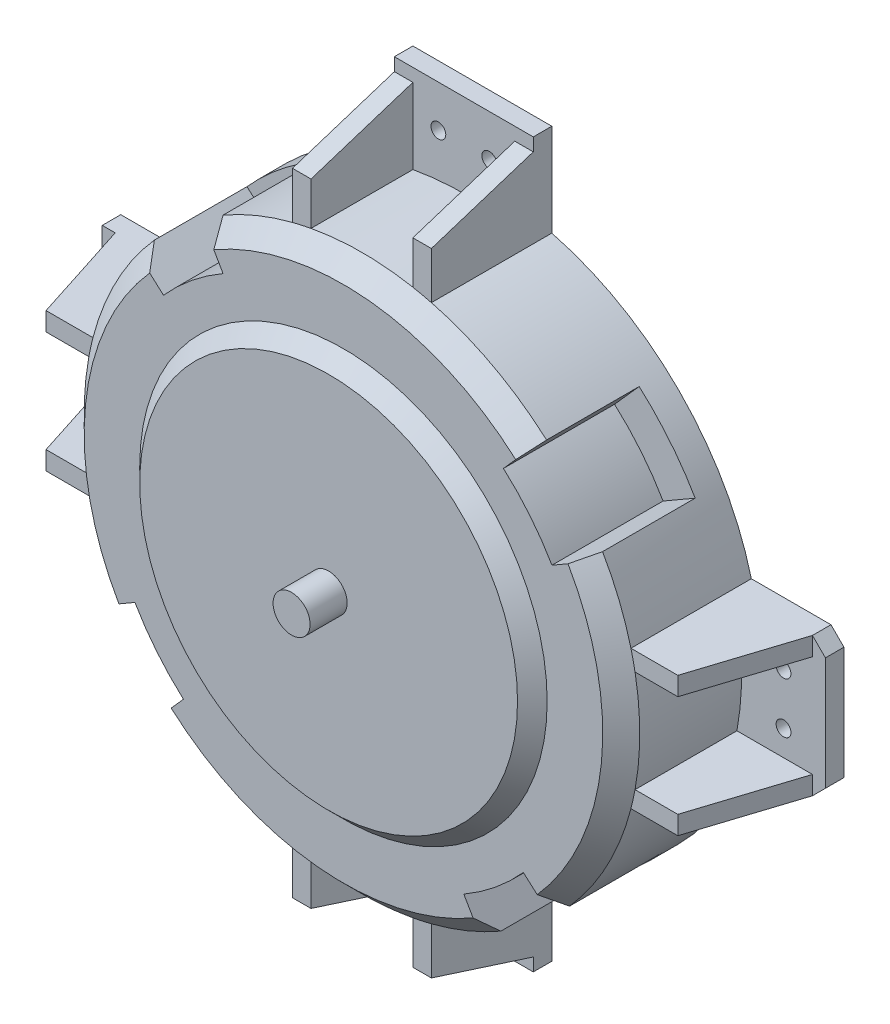
from build123d import *

# Parameters (mm, degrees)
IZIM1_R                           = 150
Y_KSEKLIK_EKSTR_ZYON1_DEPTH       = 75
PAH1_SIZE                         = 10
Y_KSEKLIK_EKSTR_ZYON2_START       = -75
Y_KSEKLIK_EKSTR_ZYON2_DEPTH       = 10
PAH2_SIZE                         = 7
Y_KSEKLIK_EKSTR_ZYON3_DEPTH       = 10
IZIM8_R                           = 4
KES_EKSTR_ZYON1_DEPTH             = 255.641782801
DAIRESEL_KAPLAMA1_COUNT           = 4
DAIRESEL_KAPLAMA1_COPY_1_DEPTH    = 10
DAIRESEL_KAPLAMA1_COPY_2_DEPTH    = 10
DAIRESEL_KAPLAMA1_COPY_3_DEPTH    = 10
DAIRESEL_KAPLAMA1_COPY_4_SKETCH_R = 4
DAIRESEL_KAPLAMA1_COPY_4_DEPTH    = 255.641782801
DAIRESEL_KAPLAMA1_COPY_5_SKETCH_R = 4
DAIRESEL_KAPLAMA1_COPY_5_DEPTH    = 255.641782801
DAIRESEL_KAPLAMA1_COPY_6_SKETCH_R = 4
DAIRESEL_KAPLAMA1_COPY_6_DEPTH    = 255.641782801
KES_EKSTR_ZYON2_START             = -60
KES_EKSTR_ZYON2_DEPTH             = 60
DAIRESEL_KAPLAMA2_COUNT           = 4
IZIM10_R                          = 110
Y_KSEKLIK_EKSTR_ZYON4_DEPTH       = 8
Y_KSEKLIK_EKSTR_ZYON4_TAPER       = 45
IZIM11_R                          = 10
Y_KSEKLIK_EKSTR_ZYON5_DEPTH       = 20


with BuildPart() as part:
    # Çizim1 → Yükseklik-Ekstrüzyon1 (new body)
    with BuildSketch(Plane.XY):
        Circle(IZIM1_R)
    extrude(amount=Y_KSEKLIK_EKSTR_ZYON1_DEPTH)

    # Pah1
    pah1_edges = [part.edges().sort_by_distance(p)[0] for p in [
        (-150, 0, 75),
    ]]
    chamfer(pah1_edges, length=PAH1_SIZE)

    # Çizim4 → Yükseklik-Ekstrüzyon2 (add)
    with BuildSketch(Plane.XY.offset(75).offset(Y_KSEKLIK_EKSTR_ZYON2_START)):
        with BuildLine():
            Line((195.236875483, -37.5), (195.236875483, 37.5))
            Line((195.236875483, 37.5), (145.236875483, 37.5))
            ThreePointArc((145.236875483, 37.5), (150, 0), (145.236875483, -37.5))
            Line((145.236875483, -37.5), (195.236875483, -37.5))
        make_face()
    y_kseklik_ekstr_zyon2 = extrude(amount=Y_KSEKLIK_EKSTR_ZYON2_DEPTH)

    # Pah2
    pah2_edges = [part.edges().sort_by_distance(p)[0] for p in [
        (195.236875483, -37.5, 5),
        (195.236875483, 37.5, 5),
    ]]
    chamfer(pah2_edges, length=PAH2_SIZE)

    # Çizim7 → Yükseklik-Ekstrüzyon3 (add)
    with BuildSketch(Plane(origin=(0, 37.5, 0), x_dir=(1, 0, 0), z_dir=(0, 1, 0))):
        Polygon((145.236875483, 0), (145.236875483, -65.015207496), (170.556875483, -65.015207496), (188.236875483, -10), (188.236875483, 0), align=None)
    y_kseklik_ekstr_zyon3 = extrude(amount=-Y_KSEKLIK_EKSTR_ZYON3_DEPTH)

    # Çizim8 → Kes-Ekstrüzyon1 (cut, through all)
    with BuildSketch(Plane.XY.offset(10)):
        with Locations((172.618437741, 13.75)):
            Circle(IZIM8_R)
    kes_ekstr_zyon1 = extrude(amount=-KES_EKSTR_ZYON1_DEPTH, mode=Mode.SUBTRACT)

    # Aynalama1: Yükseklik-Ekstrüzyon3, Kes-Ekstrüzyon1 across plane
    add(y_kseklik_ekstr_zyon3.mirror(Plane.ZX))
    add(kes_ekstr_zyon1.mirror(Plane.ZX), mode=Mode.SUBTRACT)

    # Dairesel Kaplama1: Yükseklik-Ekstrüzyon2, Yükseklik-Ekstrüzyon3, Kes-Ekstrüzyon1 ×4 about axis
    dairesel_kaplama1_axis = Axis((0, 0, 0), (0, 0, 1))
    add([y_kseklik_ekstr_zyon2.rotate(dairesel_kaplama1_axis, i * 360 / DAIRESEL_KAPLAMA1_COUNT) for i in range(1, DAIRESEL_KAPLAMA1_COUNT)])
    add([y_kseklik_ekstr_zyon3.rotate(dairesel_kaplama1_axis, i * 360 / DAIRESEL_KAPLAMA1_COUNT) for i in range(1, DAIRESEL_KAPLAMA1_COUNT)])
    add([kes_ekstr_zyon1.rotate(dairesel_kaplama1_axis, i * 360 / DAIRESEL_KAPLAMA1_COUNT) for i in range(1, DAIRESEL_KAPLAMA1_COUNT)], mode=Mode.SUBTRACT)

    # Dairesel Kaplama1 copy 1 sketch → Dairesel Kaplama1 copy 1 (add)
    with BuildSketch(Plane.YZ.offset(37.5)):
        Polygon((145.236875483, 0), (145.236875483, 65.015207496), (170.556875483, 65.015207496), (188.236875483, 10), (188.236875483, 0), align=None)
    extrude(amount=-DAIRESEL_KAPLAMA1_COPY_1_DEPTH)

    # Dairesel Kaplama1 copy 2 sketch → Dairesel Kaplama1 copy 2 (add)
    with BuildSketch(Plane(origin=(0, 37.5, 0), x_dir=(-1, 0, 0), z_dir=(0, 1, 0))):
        Polygon((145.236875483, 0), (145.236875483, 65.015207496), (170.556875483, 65.015207496), (188.236875483, 10), (188.236875483, 0), align=None)
    extrude(amount=-DAIRESEL_KAPLAMA1_COPY_2_DEPTH)

    # Dairesel Kaplama1 copy 3 sketch → Dairesel Kaplama1 copy 3 (add)
    with BuildSketch(Plane(origin=(-37.5, 0, 0), x_dir=(0, -1, 0), z_dir=(-1, 0, 0))):
        Polygon((145.236875483, 0), (145.236875483, 65.015207496), (170.556875483, 65.015207496), (188.236875483, 10), (188.236875483, 0), align=None)
    extrude(amount=-DAIRESEL_KAPLAMA1_COPY_3_DEPTH)

    # Dairesel Kaplama1 copy 4 sketch → Dairesel Kaplama1 copy 4 (cut, through all)
    with BuildSketch(Plane(origin=(0, 0, 10), x_dir=(0, 1, 0), z_dir=(0, 0, 1))):
        with Locations((172.618437741, -13.75)):
            Circle(DAIRESEL_KAPLAMA1_COPY_4_SKETCH_R)
    extrude(amount=-DAIRESEL_KAPLAMA1_COPY_4_DEPTH, mode=Mode.SUBTRACT)

    # Dairesel Kaplama1 copy 5 sketch → Dairesel Kaplama1 copy 5 (cut, through all)
    with BuildSketch(Plane(origin=(0, 0, 10), x_dir=(-1, 0, 0), z_dir=(0, 0, 1))):
        with Locations((172.618437741, -13.75)):
            Circle(DAIRESEL_KAPLAMA1_COPY_5_SKETCH_R)
    extrude(amount=-DAIRESEL_KAPLAMA1_COPY_5_DEPTH, mode=Mode.SUBTRACT)

    # Dairesel Kaplama1 copy 6 sketch → Dairesel Kaplama1 copy 6 (cut, through all)
    with BuildSketch(Plane(origin=(0, 0, 10), x_dir=(0, -1, 0), z_dir=(0, 0, 1))):
        with Locations((172.618437741, -13.75)):
            Circle(DAIRESEL_KAPLAMA1_COPY_6_SKETCH_R)
    extrude(amount=-DAIRESEL_KAPLAMA1_COPY_6_DEPTH, mode=Mode.SUBTRACT)

    # Çizim9 → Kes-Ekstrüzyon2 (cut)
    with BuildSketch(Plane.XY.offset(75).offset(KES_EKSTR_ZYON2_START)):
        with BuildLine():
            Line((-112.583302492, -65), (-129.903810568, -75))
            ThreePointArc((-129.903810568, -75), (-116.277268219, -94.760734988), (-99.673152863, -112.094882124))
            Line((-99.673152863, -112.094882124), (-86.383399148, -97.148897841))
            ThreePointArc((-86.383399148, -97.148897841), (-100.773632456, -82.125970323), (-112.583302492, -65))
        make_face()
    kes_ekstr_zyon2 = extrude(amount=KES_EKSTR_ZYON2_DEPTH, mode=Mode.SUBTRACT)

    # Dairesel Kaplama2: Kes-Ekstrüzyon2 ×4 about axis
    dairesel_kaplama2_axis = Axis((0, 0, 75), (0, 0, 1))
    for i in range(1, DAIRESEL_KAPLAMA2_COUNT):
        add(kes_ekstr_zyon2.rotate(dairesel_kaplama2_axis, i * 360 / DAIRESEL_KAPLAMA2_COUNT), mode=Mode.SUBTRACT)

    # Çizim10 → Yükseklik-Ekstrüzyon4 (add)
    with BuildSketch(Plane.XY.offset(75)):
        Circle(IZIM10_R)
    extrude(amount=Y_KSEKLIK_EKSTR_ZYON4_DEPTH, taper=Y_KSEKLIK_EKSTR_ZYON4_TAPER)

    # Çizim11 → Yükseklik-Ekstrüzyon5 (add)
    with BuildSketch(Plane.XY.offset(83)):
        Circle(IZIM11_R)
    extrude(amount=Y_KSEKLIK_EKSTR_ZYON5_DEPTH)


solid = part.part
